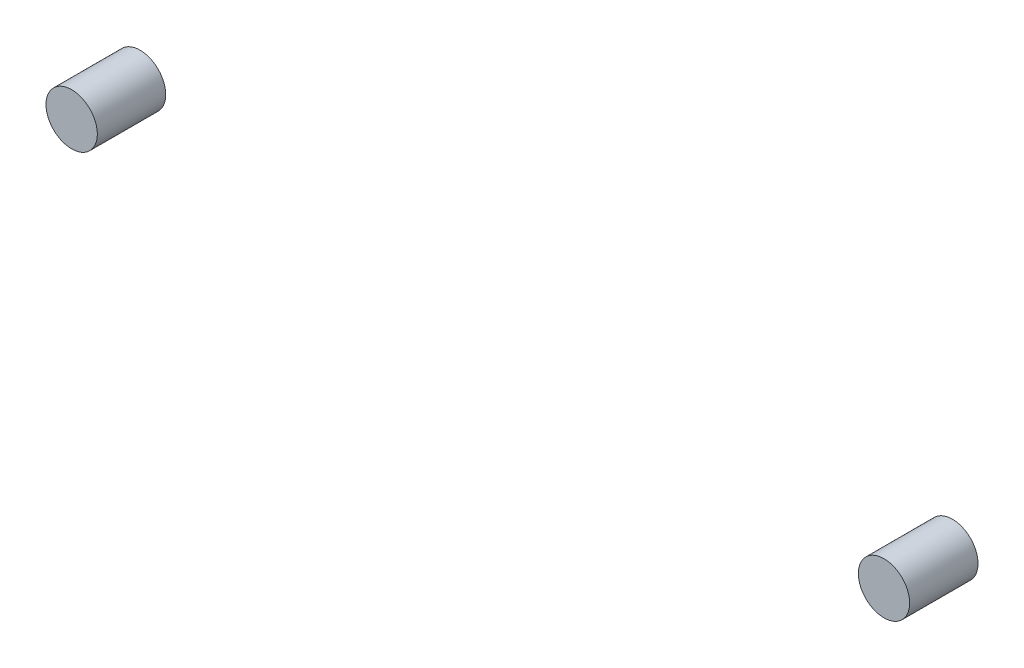
from build123d import *

# Parameters (mm, degrees)
SKETCH1_R             = 9.525
BOSS_EXTRUDE1_DEPTH   = 12.7
BOSS_EXTRUDE1_2_DEPTH = 12.7


with BuildPart() as part:
    # Sketch1 → Boss-Extrude1 (new, symmetric)
    with BuildSketch(Plane.XY):
        with Locations(Location((0, 0, 0), (0, 0, 180))):
            Circle(SKETCH1_R)
    extrude(amount=BOSS_EXTRUDE1_DEPTH, both=True)


with BuildPart() as body_2:
    # Sketch1 → Boss-Extrude1 2 (new, symmetric)
    with BuildSketch(Plane.XY):
        with Locations(Location((301.625, 0, 0), (0, 0, 180))):
            Circle(SKETCH1_R)
    extrude(amount=BOSS_EXTRUDE1_2_DEPTH, both=True)


solid = Compound([part.part, body_2.part])
